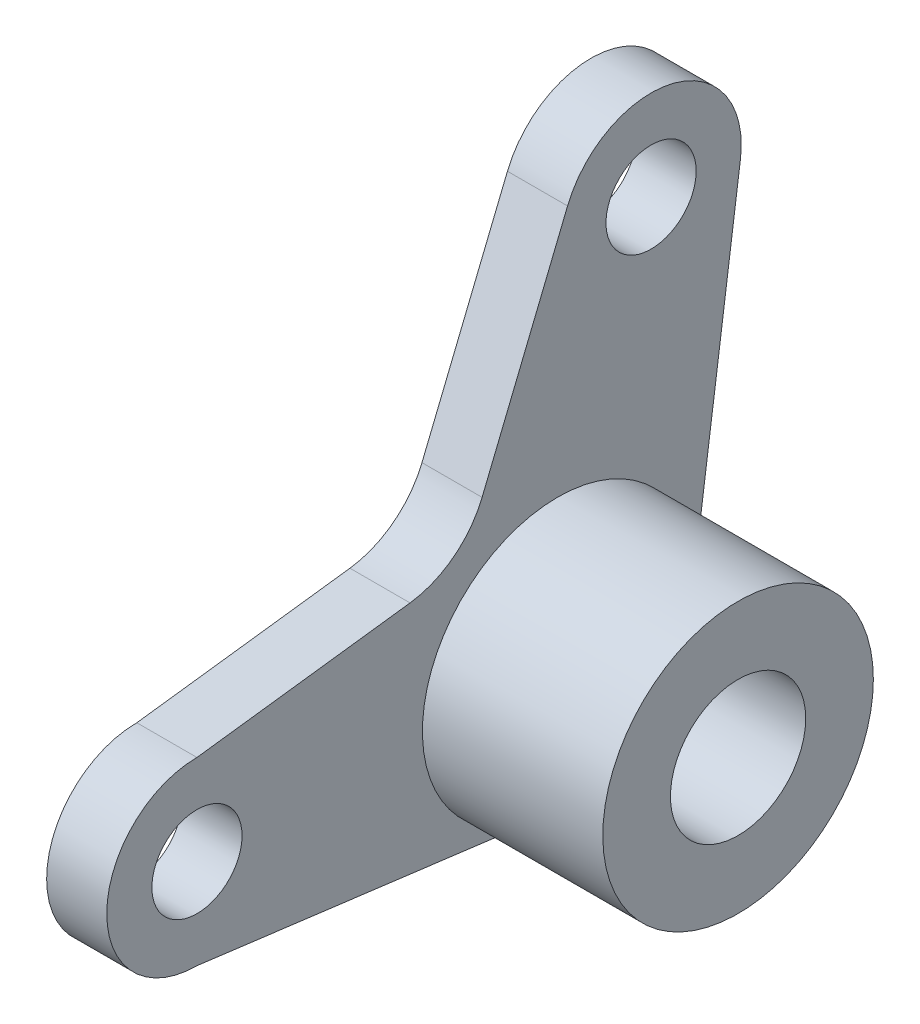
from build123d import *

# Parameters (mm, degrees)
SKETCH1_R           = 15
BOSS_EXTRUDE1_DEPTH = 20
SKETCH1_3_R         = 22.5
BOSS_EXTRUDE2_DEPTH = 80


with BuildPart() as part:
    # Sketch1 → Boss-Extrude1 (new body)
    with BuildSketch(Plane.YZ):
        with BuildLine():
            ThreePointArc((30, 120), (0, 150), (-30, 120))
            Line((-30, 120), (-44.635477489, 5.716130628))
            ThreePointArc((-44.635477489, 5.716130628), (2.863870895, 44.908776909), (45, 0))
            ThreePointArc((45, 0), (29.576190824, -33.915320083), (-6.122174948, -44.581599051))
            Line((-6.122174948, -44.581599051), (111.829649189, -60.779351446))
            ThreePointArc((111.829649189, -60.779351446), (144.888873943, -38.822856765), (127.236992817, -3.278362217))
            Line((127.236992817, -3.278362217), (57.508255637, 25.150091561))
            ThreePointArc((57.508255637, 25.150091561), (45.052202352, 34.642888154), (39.077164307, 49.119261005))
            Line((39.077164307, 49.119261005), (30, 120))
        make_face()
        with Locations((115.911099155, -31.058285412)):
            Circle(SKETCH1_R, mode=Mode.SUBTRACT)
        with Locations((0, 120)):
            Circle(SKETCH1_R, mode=Mode.SUBTRACT)
    extrude(amount=BOSS_EXTRUDE1_DEPTH)

    # Sketch1<3> → Boss-Extrude2 (add)
    with BuildSketch(Plane.YZ):
        with BuildLine():
            ThreePointArc((45, 0), (2.863870895, 44.908776909), (-44.635477489, 5.716130628))
            ThreePointArc((-44.635477489, 5.716130628), (-35.728843011, -27.357810166), (-6.122174948, -44.581599051))
            ThreePointArc((-6.122174948, -44.581599051), (29.576190824, -33.915320083), (45, 0))
        make_face()
        Circle(SKETCH1_3_R, mode=Mode.SUBTRACT)
    extrude(amount=BOSS_EXTRUDE2_DEPTH)


solid = part.part
